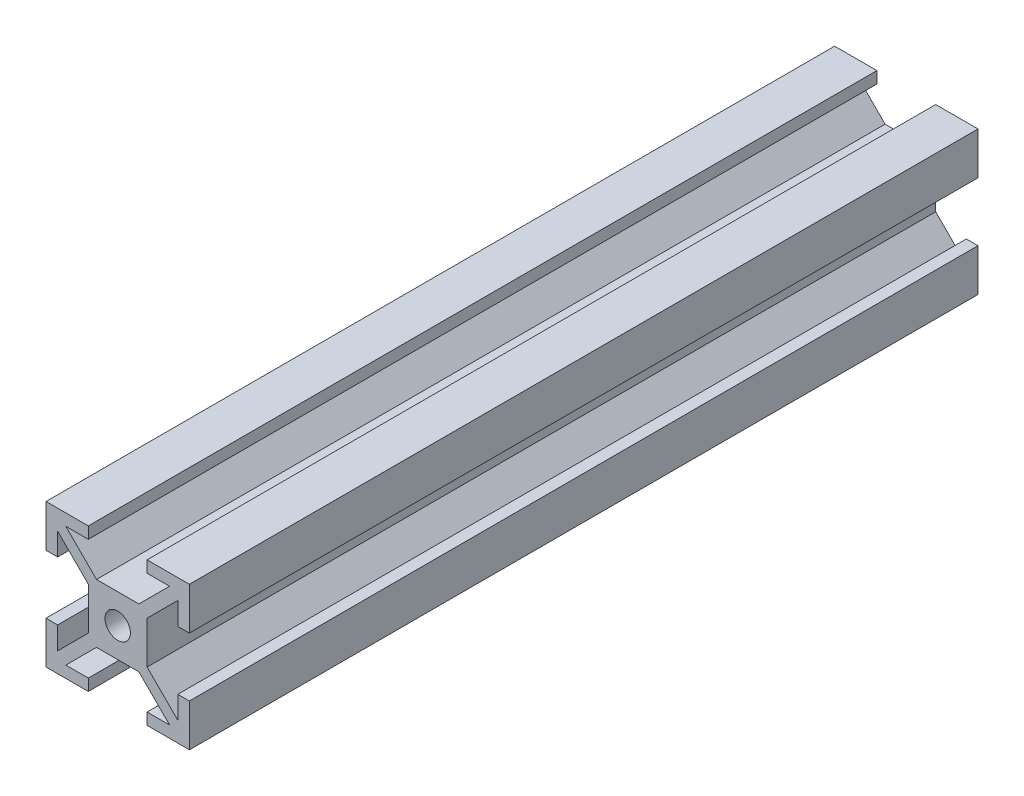
from build123d import *

# Parameters (mm, degrees)
SKETCH1_R           = 1.77
BOSS_EXTRUDE1_DEPTH = 110


with BuildPart() as part:
    # Sketch1 → Boss-Extrude1 (new body)
    with BuildSketch(Plane.XY):
        Polygon((-8.38, 4.1), (-10, 4.1), (-10, 10), (-4.1, 10), (-4.1, 8.38), (-7.234487014, 8.38), (-2.954487014, 4.1), (2.954487014, 4.1), (7.234487014, 8.38), (4.1, 8.38), (4.1, 10), (10, 10), (10, 4.1), (8.38, 4.1), (8.38, 7.234487014), (4.1, 2.954487014), (4.1, -2.954487014), (8.38, -7.234487014), (8.38, -4.1), (10, -4.1), (10, -10), (4.1, -10), (4.1, -8.38), (7.234487014, -8.38), (2.954487014, -4.1), (-2.954487014, -4.1), (-7.234487014, -8.38), (-4.1, -8.38), (-4.1, -10), (-10, -10), (-10, -4.1), (-8.38, -4.1), (-8.38, -7.234487014), (-4.1, -2.954487014), (-4.1, 2.954487014), (-8.38, 7.234487014), align=None)
        Circle(SKETCH1_R, mode=Mode.SUBTRACT)
    extrude(amount=BOSS_EXTRUDE1_DEPTH)


solid = part.part
